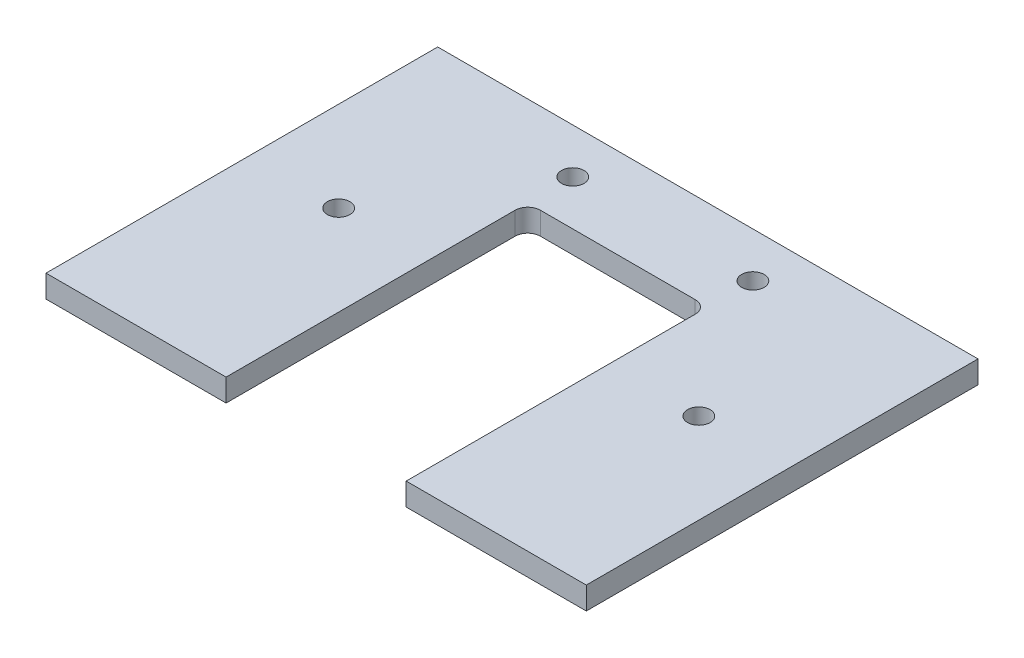
from build123d import *

# Parameters (mm, degrees)
SKETCH1_R           = 1.5875
BOSS_EXTRUDE1_DEPTH = 3.175
FILLET1_R           = 1.778


with BuildPart() as part:
    # Sketch1 → Boss-Extrude1 (new body)
    with BuildSketch(Plane(origin=(0, 0, 0), x_dir=(1, 0, 0), z_dir=(0, 1, 0))):
        Polygon((38.1, 12.7), (-38.1, 12.7), (-38.1, -42.545), (-12.7, -42.545), (-12.7, 0), (12.7, 0), (12.7, -42.545), (38.1, -42.545), align=None)
        with Locations(Location((-25.4, -13.97, 0), (0, 0, 270))):
            Circle(SKETCH1_R, mode=Mode.SUBTRACT)
        with Locations(Location((25.4, -13.97, 0), (0, 0, 90))):
            Circle(SKETCH1_R, mode=Mode.SUBTRACT)
        with Locations(Location((-12.7, 6.35, 0), (0, 0, 270))):
            Circle(SKETCH1_R, mode=Mode.SUBTRACT)
        with Locations(Location((12.7, 6.35, 0), (0, 0, 90))):
            Circle(SKETCH1_R, mode=Mode.SUBTRACT)
    extrude(amount=BOSS_EXTRUDE1_DEPTH)

    # Fillet1
    fillet1_edges = [part.edges().sort_by_distance(p)[0] for p in [
        (12.7, 1.5875, 0),
        (-12.7, 1.5875, 0),
    ]]
    fillet(fillet1_edges, radius=FILLET1_R)


solid = part.part
